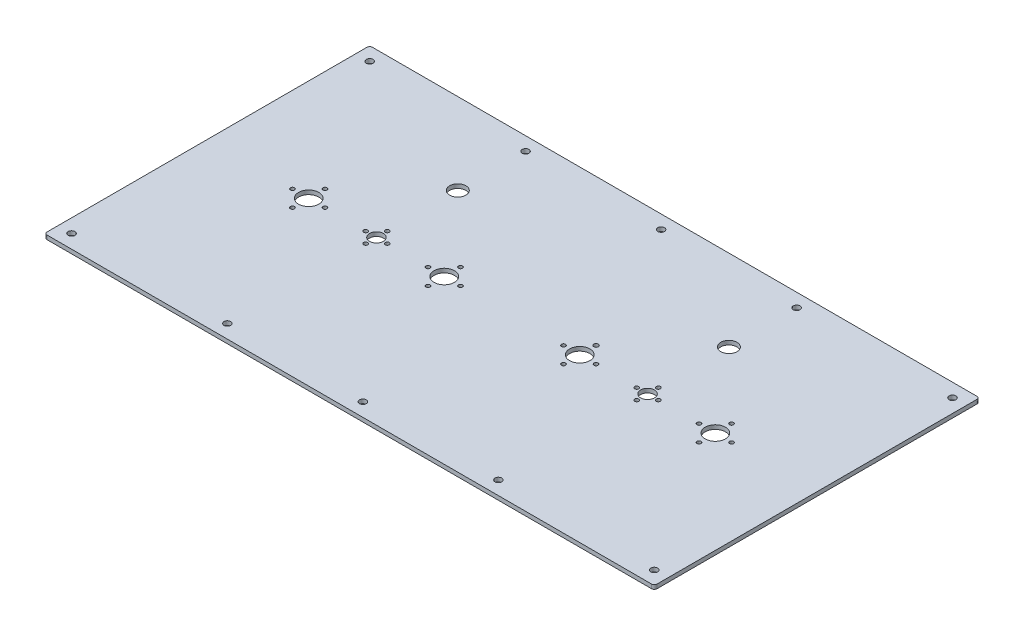
from build123d import *

# Parameters (mm, degrees)
SKETCH_1_R      = 5.1
SKETCH_1_R_2    = 1.5
SKETCH_1_R_3    = 7.5
SKETCH_1_R_4    = 6
SKETCH_1_R_5    = 1.7
SKETCH_1_R_6    = 2.5
EXTRUDE_1_DEPTH = 3


with BuildPart() as part:
    # 草图1 → 凸台-拉伸1 (new body)
    with BuildSketch(Plane(origin=(0, 0, 0), x_dir=(1, 0, 0), z_dir=(0, 1, 0))):
        with BuildLine():
            Line((-23, 220), (423, 220))
            ThreePointArc((423, 220), (424.414213562, 219.414213562), (425, 218))
            Line((425, 218), (425, -18))
            ThreePointArc((425, -18), (424.414213562, -19.414213562), (423, -20))
            Line((423, -20), (-23, -20))
            ThreePointArc((-23, -20), (-24.414213562, -19.414213562), (-25, -18))
            Line((-25, -18), (-25, 218))
            ThreePointArc((-25, 218), (-24.414213562, 219.414213562), (-23, 220))
        make_face()
        with Locations(Location((100, 100, 0), (0, 0, 270))):
            Circle(SKETCH_1_R, mode=Mode.SUBTRACT)
        with Locations(Location((150, 112, 0), (0, 0, 270))):
            Circle(SKETCH_1_R_2, mode=Mode.SUBTRACT)
        with Locations(Location((100, 92, 0), (0, 0, 270))):
            Circle(SKETCH_1_R_2, mode=Mode.SUBTRACT)
        with Locations(Location((108, 100, 0), (0, 0, 270))):
            Circle(SKETCH_1_R_2, mode=Mode.SUBTRACT)
        with Locations(Location((92, 100, 0), (0, 0, 270))):
            Circle(SKETCH_1_R_2, mode=Mode.SUBTRACT)
        with Locations(Location((100, 108, 0), (0, 0, 270))):
            Circle(SKETCH_1_R_2, mode=Mode.SUBTRACT)
        with Locations(Location((50, 100, 0), (0, 0, 270))):
            Circle(SKETCH_1_R_3, mode=Mode.SUBTRACT)
        with Locations(Location((50, 112, 0), (0, 0, 270))):
            Circle(SKETCH_1_R_2, mode=Mode.SUBTRACT)
        with Locations(Location((62, 100, 0), (0, 0, 270))):
            Circle(SKETCH_1_R_2, mode=Mode.SUBTRACT)
        with Locations(Location((50, 88, 0), (0, 0, 270))):
            Circle(SKETCH_1_R_2, mode=Mode.SUBTRACT)
        with Locations(Location((38, 100, 0), (0, 0, 270))):
            Circle(SKETCH_1_R_2, mode=Mode.SUBTRACT)
        with Locations(Location((162, 100, 0), (0, 0, 270))):
            Circle(SKETCH_1_R_2, mode=Mode.SUBTRACT)
        with Locations(Location((138, 100, 0), (0, 0, 270))):
            Circle(SKETCH_1_R_2, mode=Mode.SUBTRACT)
        with Locations(Location((150, 88, 0), (0, 0, 270))):
            Circle(SKETCH_1_R_2, mode=Mode.SUBTRACT)
        with Locations(Location((150, 100, 0), (0, 0, 270))):
            Circle(SKETCH_1_R_3, mode=Mode.SUBTRACT)
        with Locations(Location((100, 160, 0), (0, 0, 270))):
            Circle(SKETCH_1_R_4, mode=Mode.SUBTRACT)
        with Locations(Location((300, 100, 0), (0, 0, 270))):
            Circle(SKETCH_1_R, mode=Mode.SUBTRACT)
        with Locations(Location((350, 112, 0), (0, 0, 270))):
            Circle(SKETCH_1_R_2, mode=Mode.SUBTRACT)
        with Locations(Location((300, 108, 0), (0, 0, 270))):
            Circle(SKETCH_1_R_2, mode=Mode.SUBTRACT)
        with Locations(Location((308, 100, 0), (0, 0, 270))):
            Circle(SKETCH_1_R_2, mode=Mode.SUBTRACT)
        with Locations(Location((300, 92, 0), (0, 0, 270))):
            Circle(SKETCH_1_R_2, mode=Mode.SUBTRACT)
        with Locations(Location((292, 100, 0), (0, 0, 270))):
            Circle(SKETCH_1_R_2, mode=Mode.SUBTRACT)
        with Locations(Location((250, 100, 0), (0, 0, 270))):
            Circle(SKETCH_1_R_3, mode=Mode.SUBTRACT)
        with Locations(Location((250, 112, 0), (0, 0, 270))):
            Circle(SKETCH_1_R_5, mode=Mode.SUBTRACT)
        with Locations(Location((262, 100, 0), (0, 0, 270))):
            Circle(SKETCH_1_R_2, mode=Mode.SUBTRACT)
        with Locations(Location((250, 88, 0), (0, 0, 270))):
            Circle(SKETCH_1_R_2, mode=Mode.SUBTRACT)
        with Locations(Location((238, 100, 0), (0, 0, 270))):
            Circle(SKETCH_1_R_2, mode=Mode.SUBTRACT)
        with Locations(Location((362, 100, 0), (0, 0, 270))):
            Circle(SKETCH_1_R_2, mode=Mode.SUBTRACT)
        with Locations(Location((338, 100, 0), (0, 0, 270))):
            Circle(SKETCH_1_R_2, mode=Mode.SUBTRACT)
        with Locations(Location((350, 88, 0), (0, 0, 270))):
            Circle(SKETCH_1_R_2, mode=Mode.SUBTRACT)
        with Locations(Location((350, 100, 0), (0, 0, 270))):
            Circle(SKETCH_1_R_3, mode=Mode.SUBTRACT)
        with Locations(Location((300, 160, 0), (0, 0, 270))):
            Circle(SKETCH_1_R_4, mode=Mode.SUBTRACT)
        with Locations(Location((415, -10, 0), (0, 0, 270))):
            Circle(SKETCH_1_R_6, mode=Mode.SUBTRACT)
        with Locations(Location((100, -10, 0), (0, 0, 270))):
            Circle(SKETCH_1_R_6, mode=Mode.SUBTRACT)
        with Locations(Location((300, -10, 0), (0, 0, 270))):
            Circle(SKETCH_1_R_6, mode=Mode.SUBTRACT)
        with Locations(Location((-15, -10, 0), (0, 0, 270))):
            Circle(SKETCH_1_R_6, mode=Mode.SUBTRACT)
        with Locations(Location((200, -10, 0), (0, 0, 270))):
            Circle(SKETCH_1_R_6, mode=Mode.SUBTRACT)
        with Locations(Location((200, 210, 0), (0, 0, 270))):
            Circle(SKETCH_1_R_6, mode=Mode.SUBTRACT)
        with Locations(Location((-15, 210, 0), (0, 0, 270))):
            Circle(SKETCH_1_R_6, mode=Mode.SUBTRACT)
        with Locations(Location((300, 210, 0), (0, 0, 270))):
            Circle(SKETCH_1_R_6, mode=Mode.SUBTRACT)
        with Locations(Location((100, 210, 0), (0, 0, 270))):
            Circle(SKETCH_1_R_6, mode=Mode.SUBTRACT)
        with Locations(Location((415, 210, 0), (0, 0, 270))):
            Circle(SKETCH_1_R_6, mode=Mode.SUBTRACT)
    extrude(amount=EXTRUDE_1_DEPTH)


solid = part.part
